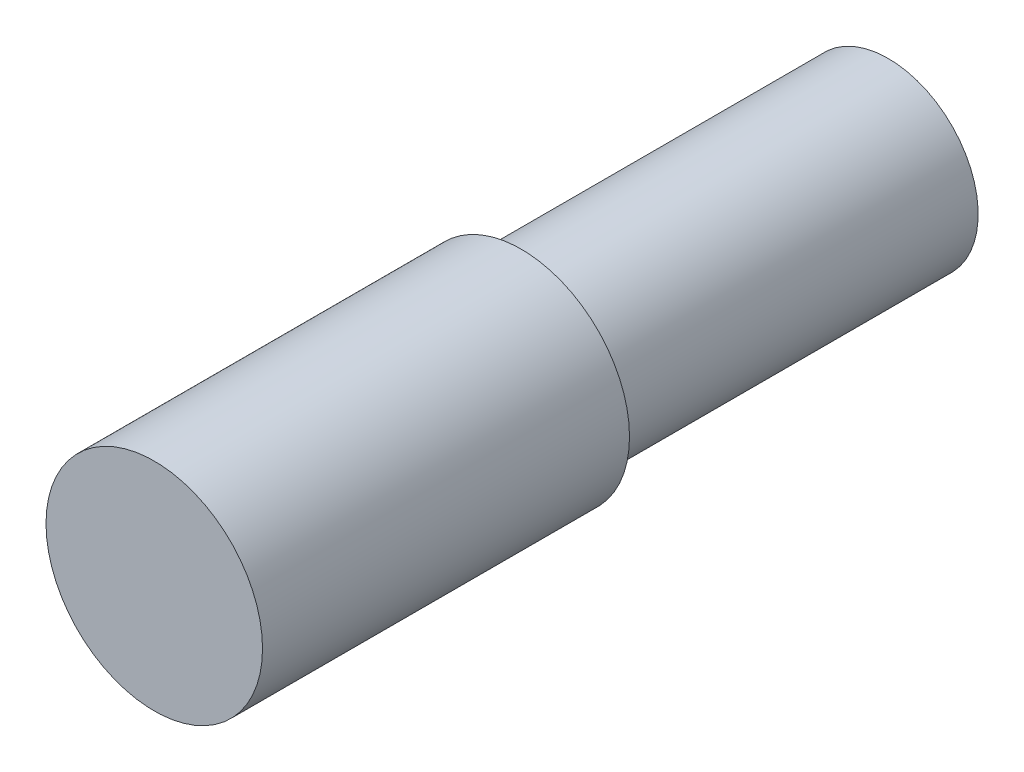
from build123d import *

# Parameters (mm, degrees)
SKIZZE1_R                       = 2.95
AUFSATZ_LINEAR_AUSTRAGEN1_DEPTH = 10
SKIZZE2_R                       = 2.45
AUFSATZ_LINEAR_AUSTRAGEN2_DEPTH = 10


with BuildPart() as part:
    # Skizze1 → Aufsatz-Linear austragen1 (new body)
    with BuildSketch(Plane.XY):
        Circle(SKIZZE1_R)
    extrude(amount=AUFSATZ_LINEAR_AUSTRAGEN1_DEPTH)

    # Skizze2 → Aufsatz-Linear austragen2 (add)
    with BuildSketch(Plane(origin=(0, 0, 0), x_dir=(-1, 0, 0), z_dir=(0, 0, -1))):
        Circle(SKIZZE2_R)
    extrude(amount=AUFSATZ_LINEAR_AUSTRAGEN2_DEPTH)


solid = part.part
